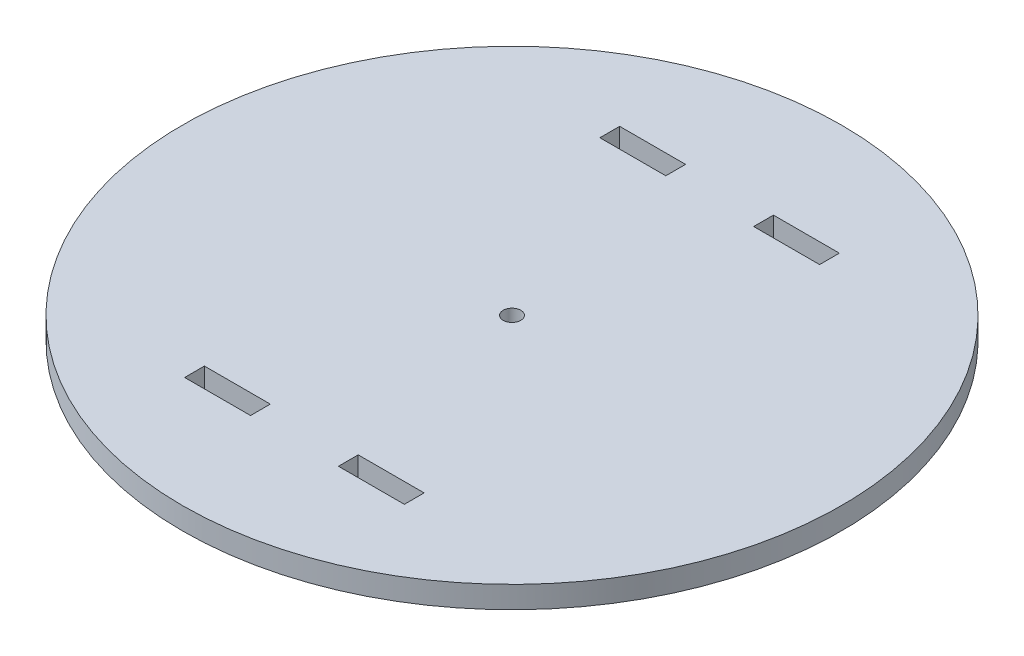
from build123d import *

# Parameters (mm, degrees)
SKETCH1_R           = 75
BOSS_EXTRUDE1_DEPTH = 5
SKETCH2_W           = 15
SKETCH2_H           = 4.5
CUT_EXTRUDE1_DEPTH  = 10
SKETCH3_R           = 2
CUT_EXTRUDE2_DEPTH  = 10


with BuildPart() as part:
    # Sketch1 → Boss-Extrude1 (new body)
    with BuildSketch(Plane(origin=(0, 0, 0), x_dir=(1, 0, 0), z_dir=(0, 1, 0))):
        with Locations(Location((0, 0, 0), (0, 0, 270))):
            Circle(SKETCH1_R)
    extrude(amount=BOSS_EXTRUDE1_DEPTH)

    # Sketch2 → Cut-Extrude1 (cut)
    with BuildSketch(Plane(origin=(0, 5, 0), x_dir=(1, 0, 0), z_dir=(0, 1, 0))):
        with Locations((-17.5, 47.25)):
            Rectangle(SKETCH2_W, SKETCH2_H)
        with Locations((17.5, 47.25)):
            Rectangle(SKETCH2_W, SKETCH2_H)
    cut_extrude1 = extrude(amount=-CUT_EXTRUDE1_DEPTH, mode=Mode.SUBTRACT)

    # Mirror1: Cut-Extrude1 across plane
    add(cut_extrude1.mirror(Plane.XY), mode=Mode.SUBTRACT)

    # Sketch3 → Cut-Extrude2 (cut)
    with BuildSketch(Plane(origin=(0, 5, 0), x_dir=(1, 0, 0), z_dir=(0, 1, 0))):
        with Locations(Location((0, 0, 0), (0, 0, 270))):
            Circle(SKETCH3_R)
    extrude(amount=-CUT_EXTRUDE2_DEPTH, mode=Mode.SUBTRACT)


solid = part.part
